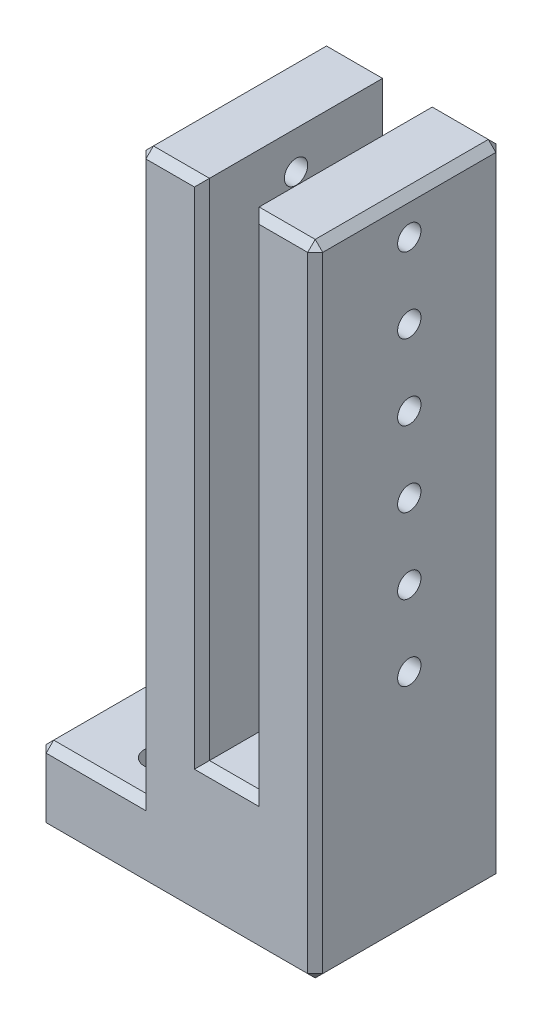
from build123d import *

# Parameters (mm, degrees)
SKETCH1_W               = 50
SKETCH1_H               = 25
BOSS_EXTRUDE1_DEPTH     = 10
SKETCH2_W               = 20
SKETCH2_H               = 25
BOSS_EXTRUDE2_DEPTH     = 75
SKETCH3_W               = 6.6
SKETCH3_H               = 25
CUT_EXTRUDE1_DEPTH      = 75
SKETCH4_R               = 1.55
CUT_EXTRUDE2_DEPTH      = 96.262794416
LPATTERN1_COUNT         = 6
LPATTERN1_PITCH         = 10
SKETCH5_W               = 15
SKETCH5_H               = 25
CUT_EXTRUDE3_DEPTH      = 94.541434669
SKETCH6_R               = 1.9
CUT_EXTRUDE4_DEPTH      = 96.262794416
SKETCH7_R               = 1.9
CUT_EXTRUDE5_DEPTH      = 87.458082329
SKETCH8_W               = 6.6
SKETCH8_H               = 8
BOSS_EXTRUDE4_DEPTH     = 25
SKETCH11_W              = 25
SKETCH11_H              = 85
BOSS_EXTRUDE5_DEPTH     = 1.75
SKETCH12_W              = 25
SKETCH12_H              = 75
BOSS_EXTRUDE6_DEPTH     = 1.75
SKETCH14_R              = 1.9
CUT_EXTRUDE7_DEPTH      = 88.18120497
CUT_EXTRUDE8_DEPTH      = 94.010160735
CUT_EXTRUDE8_DEPTH_BACK = 94.010160735
SKETCH15_R              = 1.55
CHAMFER1_SIZE           = 1


with BuildPart() as part:
    # Sketch1 → Boss-Extrude1 (new body)
    with BuildSketch(Plane(origin=(0, 0, 0), x_dir=(1, 0, 0), z_dir=(0, 1, 0))):
        with Locations((25, 12.5)):
            Rectangle(SKETCH1_W, SKETCH1_H)
    extrude(amount=BOSS_EXTRUDE1_DEPTH)

    # Sketch2 → Boss-Extrude2 (add)
    with BuildSketch(Plane(origin=(0, 10, 0), x_dir=(1, 0, 0), z_dir=(0, 1, 0))):
        with Locations((25, 12.5)):
            Rectangle(SKETCH2_W, SKETCH2_H)
    extrude(amount=BOSS_EXTRUDE2_DEPTH)

    # Sketch3 → Cut-Extrude1 (cut)
    with BuildSketch(Plane(origin=(0, 85, 0), x_dir=(1, 0, 0), z_dir=(0, 1, 0))):
        with Locations((25, 12.5)):
            Rectangle(SKETCH3_W, SKETCH3_H)
    extrude(amount=-CUT_EXTRUDE1_DEPTH, mode=Mode.SUBTRACT)

    # Sketch4 → Cut-Extrude2 (cut, symmetric)
    with BuildSketch(Plane.ZY.offset(-15)):
        with Locations((-12.5, 80)):
            Circle(SKETCH4_R)
    cut_extrude2 = extrude(amount=CUT_EXTRUDE2_DEPTH, both=True, mode=Mode.SUBTRACT)

    # LPattern1: Cut-Extrude2 ×6
    with Locations(*[(0, -i * LPATTERN1_PITCH, 0) for i in range(1, LPATTERN1_COUNT)]):
        add(cut_extrude2, mode=Mode.SUBTRACT)

    # Sketch5 → Cut-Extrude3 (cut, through all)
    with BuildSketch(Plane(origin=(0, 10, 0), x_dir=(1, 0, 0), z_dir=(0, 1, 0))):
        with Locations((42.5, 12.5)):
            Rectangle(SKETCH5_W, SKETCH5_H)
    extrude(amount=-CUT_EXTRUDE3_DEPTH, mode=Mode.SUBTRACT)

    # Sketch6 → Cut-Extrude4 (cut, through all)
    with BuildSketch(Plane.XZ):
        with Locations(Location((10.000440006, -5.930630913, 0), (0, 0, 270))):
            Circle(SKETCH6_R)
    cut_extrude4 = extrude(amount=-CUT_EXTRUDE4_DEPTH, mode=Mode.SUBTRACT)

    # Mirror1: Cut-Extrude4 across plane
    add(cut_extrude4.mirror(Plane.XY.offset(-12.5)), mode=Mode.SUBTRACT)

    # Sketch7 → Cut-Extrude5 (cut, through all)
    with BuildSketch(Plane(origin=(0, 10, 0), x_dir=(1, 0, 0), z_dir=(0, 1, 0))):
        with Locations(Location((10.000440006, 14.590630913, 0), (0, 0, 270))):
            Circle(SKETCH7_R)
        with Locations(Location((10.000440006, 5.930630913, 0), (0, 0, 90))):
            Circle(SKETCH7_R)
    extrude(amount=-CUT_EXTRUDE5_DEPTH, mode=Mode.SUBTRACT)

    # Sketch8 → Boss-Extrude4 (add, through all)
    with BuildSketch(Plane.XY):
        with Locations((25, 14)):
            Rectangle(SKETCH8_W, SKETCH8_H)
    extrude(amount=-BOSS_EXTRUDE4_DEPTH)

    # Sketch11 → Boss-Extrude5 (add)
    with BuildSketch(Plane(origin=(35, 0, 0), x_dir=(0, 0, -1), z_dir=(1, 0, 0))):
        with Locations((12.5, 42.5)):
            Rectangle(SKETCH11_W, SKETCH11_H)
    extrude(amount=BOSS_EXTRUDE5_DEPTH)

    # Sketch12 → Boss-Extrude6 (add)
    with BuildSketch(Plane.ZY.offset(-15)):
        with Locations((-12.5, 47.5)):
            Rectangle(SKETCH12_W, SKETCH12_H)
    extrude(amount=BOSS_EXTRUDE6_DEPTH)

    # Sketch14 → Cut-Extrude7 (cut, through all)
    with BuildSketch(Plane(origin=(0, 10, 0), x_dir=(1, 0, 0), z_dir=(0, 1, 0))):
        with Locations(Location((10.000440006, 10.260630913, 0), (0, 0, 270))):
            Circle(SKETCH14_R)
    extrude(amount=-CUT_EXTRUDE7_DEPTH, mode=Mode.SUBTRACT)

    # Sketch15 → Cut-Extrude8 (cut, two sides: drawn at the far end of the back side and taken through both)
    with BuildSketch(Plane.ZY.offset(-28.3).offset(-CUT_EXTRUDE8_DEPTH_BACK)):
        with Locations((-12.5, 30)):
            Circle(SKETCH15_R)
        with Locations((-12.5, 40)):
            Circle(SKETCH15_R)
        with Locations((-12.5, 50)):
            Circle(SKETCH15_R)
        with Locations((-12.5, 60)):
            Circle(SKETCH15_R)
        with Locations((-12.5, 70)):
            Circle(SKETCH15_R)
        with Locations((-12.5, 80)):
            Circle(SKETCH15_R)
    extrude(amount=CUT_EXTRUDE8_DEPTH + CUT_EXTRUDE8_DEPTH_BACK, mode=Mode.SUBTRACT)

    # Chamfer1
    chamfer1_edges = [part.edges().sort_by_distance(p)[0] for p in [
        (21.7, 51.5, -25),
        (21.7, 51.5, 0),
        (28.3, 51.5, 0),
        (28.3, 51.5, -25),
        (25, 18, -25),
        (25, 18, 0),
        (36.75, 85, -12.5),
        (36.75, 42.5, 0),
        (36.75, 0, -12.5),
        (36.75, 42.5, -25),
        (6.625, 10, -25),
        (13.25, 47.5, -25),
        (13.25, 47.5, 0),
        (13.25, 85, -12.5),
        (17.475, 85, 0),
        (32.525, 85, -25),
        (32.525, 85, 0),
        (17.475, 85, -25),
        (0, 10, -12.5),
        (18.375, 0, 0),
        (0, 0, -12.5),
        (0, 5, -25),
        (18.375, 0, -25),
        (0, 5, 0),
        (6.625, 10, 0),
    ]]
    chamfer(chamfer1_edges, length=CHAMFER1_SIZE)


solid = part.part
